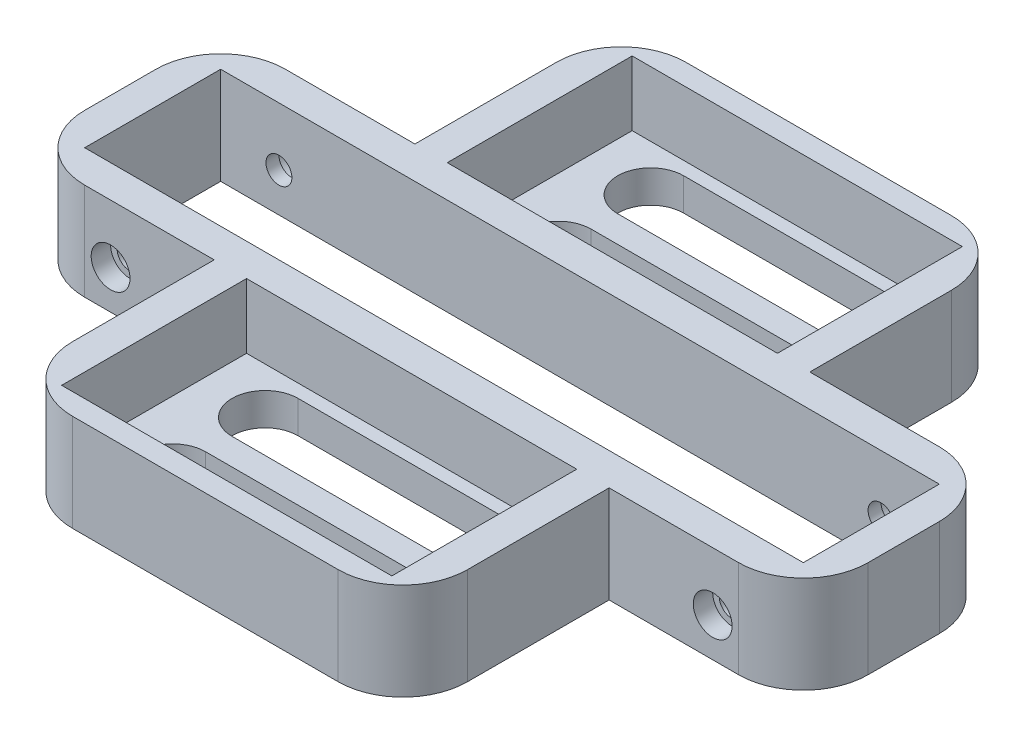
from build123d import *

# Parameters (mm, degrees)
BOSS_EXTRUDE1_DEPTH            = 10
SKETCH1_3_W                    = 51
SKETCH1_3_H                    = 28.56
BOSS_EXTRUDE2_DEPTH            = 5
CUT_EXTRUDE1_REACH             = 79.48
SKETCH3_R                      = 3
SKETCH3_R_2                    = 2
CUT_EXTRUDE1_DIRECTION_2_REACH = 79.48
BOSS_EXTRUDE3_DEPTH            = 12.5
BOSS_EXTRUDE3_DEPTH_BACK       = 12.5
SKETCH3_5_R                    = 3
SKETCH3_5_R_2                  = 2
CUT_EXTRUDE5_DEPTH             = 10.5
CUT_EXTRUDE5_DEPTH_BACK        = 10.5
SKETCH3_12_R                   = 3
SKETCH3_12_R_2                 = 2
FILLET1_R                      = 10


with BuildPart() as part:
    # Sketch1 → Boss-Extrude1 (new body)
    # profile 1 of 3: a face of its own
    with BuildSketch(Plane(origin=(0, 0, 0), x_dir=(1, 0, 0), z_dir=(0, 1, 0))):
        Polygon((-30.5, 47.36), (-30.5, 15.5), (-25.5, 15.5), (-25.5, 44.06), (25.5, 44.06), (25.5, 15.5), (30.5, 15.5), (30.5, 47.36), align=None)
    # profile 2 of 3: a face of its own
    with BuildSketch(Plane(origin=(0, 0, 0), x_dir=(1, 0, 0), z_dir=(0, 1, 0))):
        Polygon((30.5, 15.5), (-30.5, 15.5), (-60.5, 15.5), (-60.5, -15.5), (-30.5, -15.5), (30.5, -15.5), (60.5, -15.5), (60.5, 15.5), align=None)
        Polygon((30.5, 10.5), (-30.5, 10.5), (-55.5, 10.5), (-55.5, -10.5), (-30.5, -10.5), (30.5, -10.5), (55.5, -10.5), (55.5, 10.5), align=None, mode=Mode.SUBTRACT)
    # profile 3 of 3: a face of its own
    with BuildSketch(Plane(origin=(0, 0, 0), x_dir=(1, 0, 0), z_dir=(0, 1, 0))):
        Polygon((-30.5, -15.5), (-30.5, -47.36), (30.5, -47.36), (30.5, -15.5), (25.5, -15.5), (25.5, -44.06), (-25.5, -44.06), (-25.5, -15.5), align=None)
    extrude(amount=BOSS_EXTRUDE1_DEPTH)

    # Sketch1<3> → Boss-Extrude2 (add)
    # profile 1 of 5: a face of its own
    with BuildSketch(Plane(origin=(0, 0, 0), x_dir=(1, 0, 0), z_dir=(0, 1, 0))):
        Polygon((-30.5, -15.5), (-30.5, -47.36), (30.5, -47.36), (30.5, -15.5), (25.5, -15.5), (25.5, -44.06), (-25.5, -44.06), (-25.5, -15.5), align=None)
    # profile 2 of 5: a face of its own
    with BuildSketch(Plane(origin=(0, 0, 0), x_dir=(1, 0, 0), z_dir=(0, 1, 0))):
        Polygon((-60.5, -15.5), (-30.5, -15.5), (-25.5, -15.5), (25.5, -15.5), (30.5, -15.5), (60.5, -15.5), (60.5, 15.5), (30.5, 15.5), (25.5, 15.5), (-25.5, 15.5), (-30.5, 15.5), (-60.5, 15.5), align=None)
        Polygon((-55.5, 10.5), (-30.5, 10.5), (30.5, 10.5), (55.5, 10.5), (55.5, -10.5), (30.5, -10.5), (-30.5, -10.5), (-55.5, -10.5), align=None, mode=Mode.SUBTRACT)
    # profile 3 of 5: a face of its own
    with BuildSketch(Plane(origin=(0, 0, 0), x_dir=(1, 0, 0), z_dir=(0, 1, 0))):
        with Locations((0, -29.78)):
            Rectangle(SKETCH1_3_W, SKETCH1_3_H)
        with BuildLine():
            ThreePointArc((-15.5, -27.73), (-20.59, -22.64), (-15.5, -17.55))
            Line((-15.5, -17.55), (15.5, -17.55))
            ThreePointArc((15.5, -17.55), (20.59, -22.64), (15.5, -27.73))
            Line((15.5, -27.73), (-15.5, -27.73))
        make_face(mode=Mode.SUBTRACT)
        with BuildLine():
            Line((15.5, -42.01), (-15.5, -42.01))
            ThreePointArc((-15.5, -42.01), (-20.59, -36.92), (-15.5, -31.83))
            Line((-15.5, -31.83), (15.5, -31.83))
            ThreePointArc((15.5, -31.83), (20.59, -36.92), (15.5, -42.01))
        make_face(mode=Mode.SUBTRACT)
    # profile 4 of 5: a face of its own
    with BuildSketch(Plane(origin=(0, 0, 0), x_dir=(1, 0, 0), z_dir=(0, 1, 0))):
        Polygon((-30.5, 47.36), (-30.5, 15.5), (-25.5, 15.5), (-25.5, 44.06), (25.5, 44.06), (25.5, 15.5), (30.5, 15.5), (30.5, 47.36), align=None)
    # profile 5 of 5: a face of its own
    with BuildSketch(Plane(origin=(0, 0, 0), x_dir=(1, 0, 0), z_dir=(0, 1, 0))):
        with Locations((0, 29.78)):
            Rectangle(SKETCH1_3_W, SKETCH1_3_H)
        with BuildLine():
            Line((15.5, 17.55), (-15.5, 17.55))
            ThreePointArc((-15.5, 17.55), (-20.59, 22.64), (-15.5, 27.73))
            Line((-15.5, 27.73), (15.5, 27.73))
            ThreePointArc((15.5, 27.73), (20.59, 22.64), (15.5, 17.55))
        make_face(mode=Mode.SUBTRACT)
        with BuildLine():
            ThreePointArc((-15.5, 31.83), (-20.59, 36.92), (-15.5, 42.01))
            Line((-15.5, 42.01), (15.5, 42.01))
            ThreePointArc((15.5, 42.01), (20.59, 36.92), (15.5, 31.83))
            Line((15.5, 31.83), (-15.5, 31.83))
        make_face(mode=Mode.SUBTRACT)
    extrude(amount=-BOSS_EXTRUDE2_DEPTH)

    # Cut-Extrude1: up to this face of the body (flat: up to its plane)
    cut_extrude1_end = Plane(part.part.faces().sort_by_distance((-45.5, 2.5, -15.5))[0])
    # Sketch3 → Cut-Extrude1 (cut, up to the picked face)
    with BuildSketch(Plane.XY, mode=Mode.PRIVATE) as cut_extrude1_sk1:
        with Locations((-46.5, 1)):
            Circle(SKETCH3_R)
        with Locations((-46.5, 1)):
            Circle(SKETCH3_R_2, mode=Mode.SUBTRACT)
    cut_extrude1_tool1 = split(extrude(cut_extrude1_sk1.sketch, amount=-CUT_EXTRUDE1_REACH, mode=Mode.PRIVATE), bisect_by=cut_extrude1_end, keep=Keep.BOTH, mode=Mode.PRIVATE)
    # Sketch3 → Cut-Extrude1 (cut, up to the picked face)
    with BuildSketch(Plane.XY, mode=Mode.PRIVATE) as cut_extrude1_sk2:
        with Locations((-46.5, 1)):
            Circle(SKETCH3_R_2)
    cut_extrude1_tool2 = split(extrude(cut_extrude1_sk2.sketch, amount=-CUT_EXTRUDE1_REACH, mode=Mode.PRIVATE), bisect_by=cut_extrude1_end, keep=Keep.BOTH, mode=Mode.PRIVATE)
    # Sketch3 → Cut-Extrude1 (cut, up to the picked face)
    with BuildSketch(Plane.XY, mode=Mode.PRIVATE) as cut_extrude1_sk3:
        with Locations((46.5, 1)):
            Circle(SKETCH3_R)
        with Locations((46.5, 1)):
            Circle(SKETCH3_R_2, mode=Mode.SUBTRACT)
    cut_extrude1_tool3 = split(extrude(cut_extrude1_sk3.sketch, amount=-CUT_EXTRUDE1_REACH, mode=Mode.PRIVATE), bisect_by=cut_extrude1_end, keep=Keep.BOTH, mode=Mode.PRIVATE)
    # Sketch3 → Cut-Extrude1 (cut, up to the picked face)
    with BuildSketch(Plane.XY, mode=Mode.PRIVATE) as cut_extrude1_sk4:
        with Locations((46.5, 1)):
            Circle(SKETCH3_R_2)
    cut_extrude1_tool4 = split(extrude(cut_extrude1_sk4.sketch, amount=-CUT_EXTRUDE1_REACH, mode=Mode.PRIVATE), bisect_by=cut_extrude1_end, keep=Keep.BOTH, mode=Mode.PRIVATE)
    add(cut_extrude1_tool1.solids().sort_by(Axis((-49.415147, 1, 0), (0, 0, -1)))[0], mode=Mode.SUBTRACT)
    add(cut_extrude1_tool2.solids().sort_by(Axis((-46.5, 1, 0), (0, 0, -1)))[0], mode=Mode.SUBTRACT)
    add(cut_extrude1_tool3.solids().sort_by(Axis((43.584853, 1, 0), (0, 0, -1)))[0], mode=Mode.SUBTRACT)
    add(cut_extrude1_tool4.solids().sort_by(Axis((46.5, 1, 0), (0, 0, -1)))[0], mode=Mode.SUBTRACT)

    # Cut-Extrude1 direction 2: up to this face of the body (flat: up to its plane)
    cut_extrude1_direction_2_end = Plane(part.part.faces().sort_by_distance((-45.5, 2.5, 15.5))[0])
    # Sketch3 → Cut-Extrude1 direction 2 (cut, up to the picked face)
    with BuildSketch(Plane.XY, mode=Mode.PRIVATE) as cut_extrude1_direction_2_sk1:
        with Locations((-46.5, 1)):
            Circle(SKETCH3_R)
        with Locations((-46.5, 1)):
            Circle(SKETCH3_R_2, mode=Mode.SUBTRACT)
    cut_extrude1_direction_2_tool1 = split(extrude(cut_extrude1_direction_2_sk1.sketch, amount=CUT_EXTRUDE1_DIRECTION_2_REACH, mode=Mode.PRIVATE), bisect_by=cut_extrude1_direction_2_end, keep=Keep.BOTH, mode=Mode.PRIVATE)
    # Sketch3 → Cut-Extrude1 direction 2 (cut, up to the picked face)
    with BuildSketch(Plane.XY, mode=Mode.PRIVATE) as cut_extrude1_direction_2_sk2:
        with Locations((-46.5, 1)):
            Circle(SKETCH3_R_2)
    cut_extrude1_direction_2_tool2 = split(extrude(cut_extrude1_direction_2_sk2.sketch, amount=CUT_EXTRUDE1_DIRECTION_2_REACH, mode=Mode.PRIVATE), bisect_by=cut_extrude1_direction_2_end, keep=Keep.BOTH, mode=Mode.PRIVATE)
    # Sketch3 → Cut-Extrude1 direction 2 (cut, up to the picked face)
    with BuildSketch(Plane.XY, mode=Mode.PRIVATE) as cut_extrude1_direction_2_sk3:
        with Locations((46.5, 1)):
            Circle(SKETCH3_R)
        with Locations((46.5, 1)):
            Circle(SKETCH3_R_2, mode=Mode.SUBTRACT)
    cut_extrude1_direction_2_tool3 = split(extrude(cut_extrude1_direction_2_sk3.sketch, amount=CUT_EXTRUDE1_DIRECTION_2_REACH, mode=Mode.PRIVATE), bisect_by=cut_extrude1_direction_2_end, keep=Keep.BOTH, mode=Mode.PRIVATE)
    # Sketch3 → Cut-Extrude1 direction 2 (cut, up to the picked face)
    with BuildSketch(Plane.XY, mode=Mode.PRIVATE) as cut_extrude1_direction_2_sk4:
        with Locations((46.5, 1)):
            Circle(SKETCH3_R_2)
    cut_extrude1_direction_2_tool4 = split(extrude(cut_extrude1_direction_2_sk4.sketch, amount=CUT_EXTRUDE1_DIRECTION_2_REACH, mode=Mode.PRIVATE), bisect_by=cut_extrude1_direction_2_end, keep=Keep.BOTH, mode=Mode.PRIVATE)
    add(cut_extrude1_direction_2_tool1.solids().sort_by(Axis((-49.415147, 1, 0), (0, 0, 1)))[0], mode=Mode.SUBTRACT)
    add(cut_extrude1_direction_2_tool2.solids().sort_by(Axis((-46.5, 1, 0), (0, 0, 1)))[0], mode=Mode.SUBTRACT)
    add(cut_extrude1_direction_2_tool3.solids().sort_by(Axis((43.584853, 1, 0), (0, 0, 1)))[0], mode=Mode.SUBTRACT)
    add(cut_extrude1_direction_2_tool4.solids().sort_by(Axis((46.5, 1, 0), (0, 0, 1)))[0], mode=Mode.SUBTRACT)

    # Sketch3<5> → Boss-Extrude3 (add, two sides: drawn at the far end of the back side and taken through both)
    # profile 1 of 2: a face of its own
    with BuildSketch(Plane.XY.offset(-BOSS_EXTRUDE3_DEPTH_BACK)):
        with Locations((-46.5, 1)):
            Circle(SKETCH3_5_R)
        with Locations((-46.5, 1)):
            Circle(SKETCH3_5_R_2, mode=Mode.SUBTRACT)
    # profile 2 of 2: a face of its own
    with BuildSketch(Plane.XY.offset(-BOSS_EXTRUDE3_DEPTH_BACK)):
        with Locations((46.5, 1)):
            Circle(SKETCH3_5_R)
        with Locations((46.5, 1)):
            Circle(SKETCH3_5_R_2, mode=Mode.SUBTRACT)
    extrude(amount=BOSS_EXTRUDE3_DEPTH + BOSS_EXTRUDE3_DEPTH_BACK)

    # Sketch3<12> → Cut-Extrude5 (cut, two sides: drawn at the far end of the back side and taken through both)
    # profile 1 of 2: a face of its own
    with BuildSketch(Plane.XY.offset(-CUT_EXTRUDE5_DEPTH_BACK)):
        with Locations((46.5, 1)):
            Circle(SKETCH3_12_R)
        with Locations((46.5, 1)):
            Circle(SKETCH3_12_R_2, mode=Mode.SUBTRACT)
    # profile 2 of 2: a face of its own
    with BuildSketch(Plane.XY.offset(-CUT_EXTRUDE5_DEPTH_BACK)):
        with Locations((-46.5, 1)):
            Circle(SKETCH3_12_R)
        with Locations((-46.5, 1)):
            Circle(SKETCH3_12_R_2, mode=Mode.SUBTRACT)
    extrude(amount=CUT_EXTRUDE5_DEPTH + CUT_EXTRUDE5_DEPTH_BACK, mode=Mode.SUBTRACT)

    # Fillet1
    fillet1_edges = [part.edges().sort_by_distance(p)[0] for p in [
        (60.5, 2.5, -15.5),
        (60.5, 2.5, 15.5),
        (30.5, 2.5, 47.36),
        (-30.5, 2.5, 47.36),
        (-60.5, 2.5, 15.5),
        (-60.5, 2.5, -15.5),
        (-30.5, 2.5, -47.36),
        (30.5, 2.5, -47.36),
    ]]
    fillet(fillet1_edges, radius=FILLET1_R)


solid = part.part
